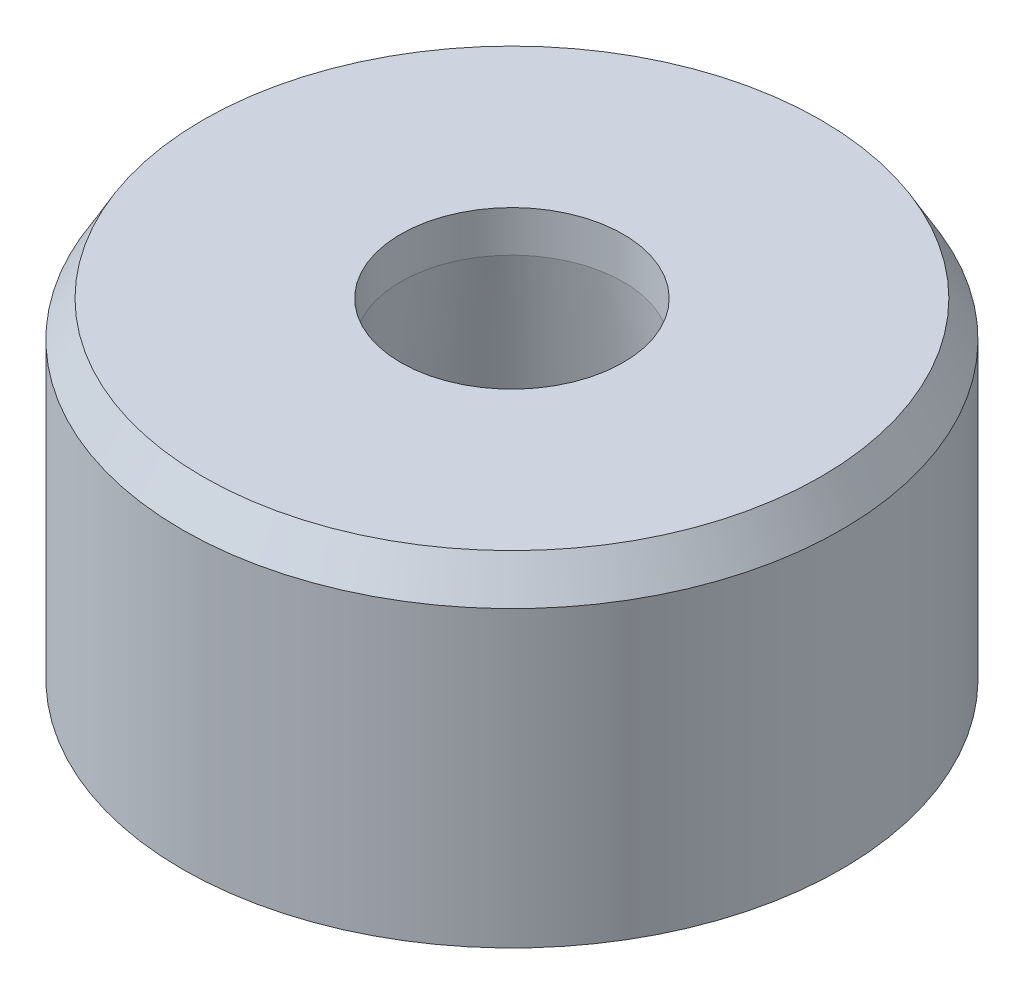
from build123d import *

# Parameters (mm, degrees)
SKETCH1_R           = 8
SKETCH1_R_2         = 2.7
BOSS_EXTRUDE1_DEPTH = 8
CHAMFER1_SIZE       = 7
CHAMFER1_SIZE2      = 0.983785843
CHAMFER2_SIZE       = 0.5
CHAMFER2_SIZE2      = 0.866025404


with BuildPart() as part:
    # Sketch1 → Boss-Extrude1 (new body)
    with BuildSketch(Plane(origin=(0, 0, 0), x_dir=(1, 0, 0), z_dir=(0, 1, 0))):
        with Locations(Location((0, 0, 0), (0, 0, 270))):
            Circle(SKETCH1_R)
        with Locations(Location((0, 0, 0), (0, 0, 270))):
            Circle(SKETCH1_R_2, mode=Mode.SUBTRACT)
    extrude(amount=BOSS_EXTRUDE1_DEPTH)

    # Chamfer1
    chamfer1_edges = [part.edges().sort_by_distance(p)[0] for p in [
        (0, 0, -2.7),
    ]]
    chamfer1_side = [part.faces().sort_by_distance(p)[0] for p in [
        (0, 4, -2.7),
    ]]
    chamfer(chamfer1_edges, length=CHAMFER1_SIZE, length2=CHAMFER1_SIZE2, reference=chamfer1_side[0])

    # Chamfer2
    chamfer2_edges = [part.edges().sort_by_distance(p)[0] for p in [
        (0, 8, -8),
    ]]
    chamfer2_side = [part.faces().sort_by_distance(p)[0] for p in [
        (0, 8, -7.77372583),
    ]]
    chamfer(chamfer2_edges, length=CHAMFER2_SIZE, length2=CHAMFER2_SIZE2, reference=chamfer2_side[0])


solid = part.part
